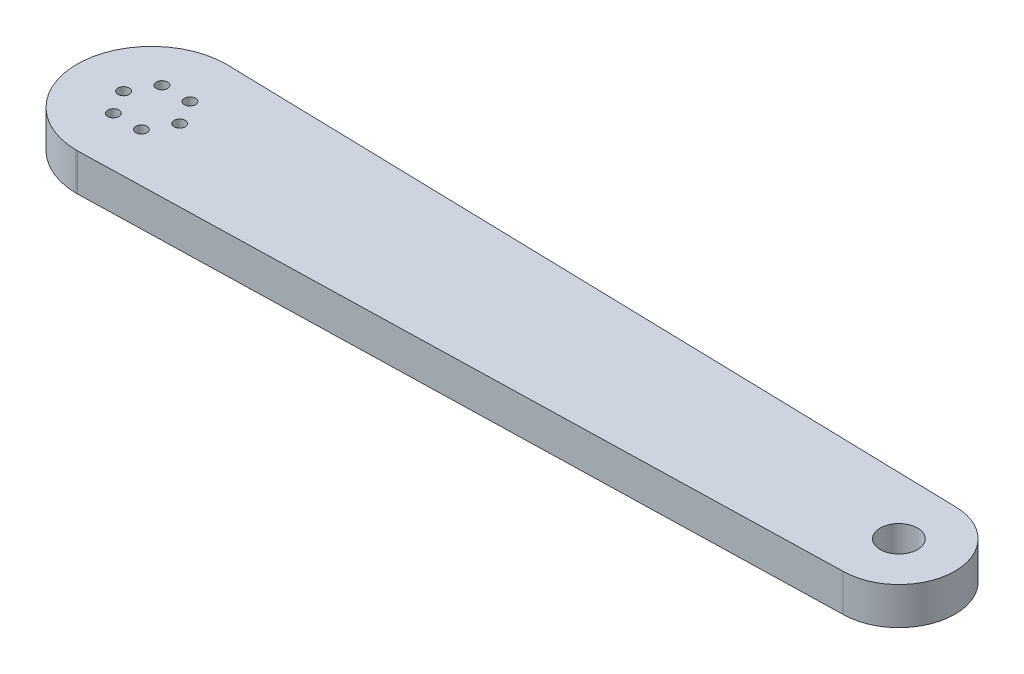
from build123d import *

# Parameters (mm, degrees)
CROQUIS1_R              = 1.5
CROQUIS1_R_2            = 5
SALIENTE_EXTRUIR1_DEPTH = 10


with BuildPart() as part:
    # Croquis1 → Saliente-Extruir1 (new body)
    with BuildSketch(Plane(origin=(0, 0, 0), x_dir=(1, 0, 0), z_dir=(0, 1, 0))):
        with BuildLine():
            Line((0.146382734, 19.996340432), (200, 15))
            ThreePointArc((200, 15), (215, 0), (200, -15))
            Line((200, -15), (0.146382734, -19.996340432))
            ThreePointArc((0.146382734, -19.996340432), (-0.030336377, -19.999196031), (-0.207078355, -19.998927935))
            ThreePointArc((-0.207078355, -19.998927935), (-20, 0), (-0.207078355, 19.998927935))
            ThreePointArc((-0.207078355, 19.998927935), (-0.030336377, 19.999196031), (0.146382734, 19.996340432))
        make_face()
        with Locations(Location((7.5, 0, 0), (0, 0, 270))):
            Circle(CROQUIS1_R, mode=Mode.SUBTRACT)
        with Locations(Location((3.75, -6.495190528, 0), (0, 0, 270))):
            Circle(CROQUIS1_R, mode=Mode.SUBTRACT)
        with Locations(Location((-3.75, -6.495190528, 0), (0, 0, 270))):
            Circle(CROQUIS1_R, mode=Mode.SUBTRACT)
        with Locations(Location((-7.5, 0, 0), (0, 0, 270))):
            Circle(CROQUIS1_R, mode=Mode.SUBTRACT)
        with Locations(Location((-3.75, 6.495190528, 0), (0, 0, 270))):
            Circle(CROQUIS1_R, mode=Mode.SUBTRACT)
        with Locations(Location((3.75, 6.495190528, 0), (0, 0, 270))):
            Circle(CROQUIS1_R, mode=Mode.SUBTRACT)
        with Locations(Location((200, 0, 0), (0, 0, 270))):
            Circle(CROQUIS1_R_2, mode=Mode.SUBTRACT)
    extrude(amount=SALIENTE_EXTRUIR1_DEPTH)


solid = part.part
